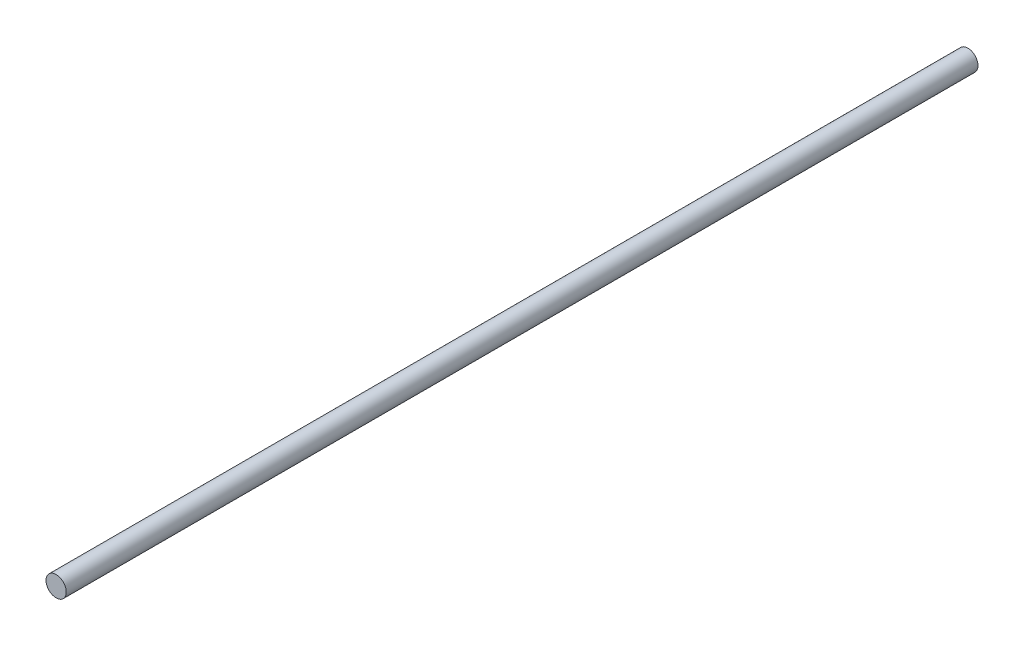
from build123d import *

# Parameters (mm, degrees)
SKETCH_1_R      = 4
EXTRUDE_1_DEPTH = 360


with BuildPart() as part:
    # Эскиз1 → Бобышка-Вытянуть1 (new body)
    with BuildSketch(Plane.XY):
        with Locations(Location((0, 0, 0), (0, 0, 180))):
            Circle(SKETCH_1_R)
    extrude(amount=EXTRUDE_1_DEPTH)


solid = part.part
